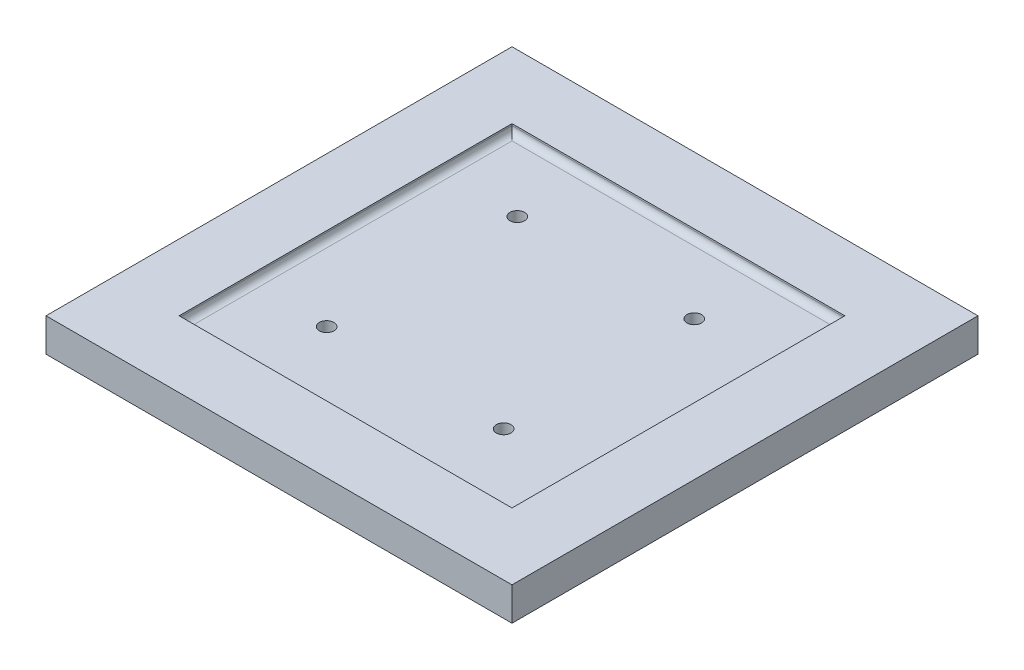
from build123d import *

# Parameters (mm, degrees)
SKETCH10_W          = 177.8
SKETCH10_H          = 177.8
BOSS_EXTRUDE4_DEPTH = 12.7
SKETCH12_W          = 127
SKETCH12_H          = 127
BOSS_EXTRUDE5_DEPTH = 3.175
SKETCH13_W          = 127
SKETCH13_H          = 127
CUT_EXTRUDE1_DEPTH  = 3.175
SKETCH14_W          = 127
SKETCH14_H          = 127
CUT_EXTRUDE2_DEPTH  = 3.175
FILLET4_R           = 2.54
SKETCH16_R          = 2.794
CUT_EXTRUDE3_DEPTH  = 25.4


with BuildPart() as part:
    # Sketch10 → Boss-Extrude4 (new body)
    with BuildSketch(Plane(origin=(0, 0, 0), x_dir=(1, 0, 0), z_dir=(0, 1, 0))):
        Rectangle(SKETCH10_W, SKETCH10_H)
    extrude(amount=BOSS_EXTRUDE4_DEPTH)

    # Sketch12 → Boss-Extrude5 (add)
    with BuildSketch(Plane(origin=(0, 12.7, 0), x_dir=(1, 0, 0), z_dir=(0, 1, 0))):
        Rectangle(SKETCH12_W, SKETCH12_H)
    extrude(amount=-BOSS_EXTRUDE5_DEPTH)

    # Sketch13 → Cut-Extrude1 (cut)
    with BuildSketch(Plane(origin=(0, 12.7, 0), x_dir=(1, 0, 0), z_dir=(0, 1, 0))):
        Rectangle(SKETCH13_W, SKETCH13_H)
    extrude(amount=-CUT_EXTRUDE1_DEPTH, mode=Mode.SUBTRACT)

    # Sketch14 → Cut-Extrude2 (cut)
    with BuildSketch(Plane(origin=(0, 0, 0), x_dir=(-1, 0, 0), z_dir=(0, -1, 0))):
        Rectangle(SKETCH14_W, SKETCH14_H)
    extrude(amount=-CUT_EXTRUDE2_DEPTH, mode=Mode.SUBTRACT)

    # Fillet4
    fillet4_edges = [part.edges().sort_by_distance(p)[0] for p in [
        (-63.5, 9.525, 0),
        (0, 9.525, -63.5),
        (63.5, 9.525, 0),
        (0, 9.525, 63.5),
        (63.5, 3.175, 0),
        (0, 3.175, -63.5),
        (-63.5, 3.175, 0),
        (0, 3.175, 63.5),
    ]]
    fillet(fillet4_edges, radius=FILLET4_R)

    # Sketch16 → Cut-Extrude3 (cut)
    with BuildSketch(Plane(origin=(0, 9.525, 0), x_dir=(1, 0, 0), z_dir=(0, 1, 0))):
        with Locations(Location((-34.945581996, 36.952591773, 0), (0, 0, 270))):
            Circle(SKETCH16_R)
        with Locations(Location((32.584394023, 36.952591773, 0), (0, 0, 270))):
            Circle(SKETCH16_R)
        with Locations(Location((-34.945581996, -35.771997786, 0), (0, 0, 270))):
            Circle(SKETCH16_R)
        with Locations(Location((32.584394023, -35.771997786, 0), (0, 0, 270))):
            Circle(SKETCH16_R)
    extrude(amount=-CUT_EXTRUDE3_DEPTH, mode=Mode.SUBTRACT)


solid = part.part
